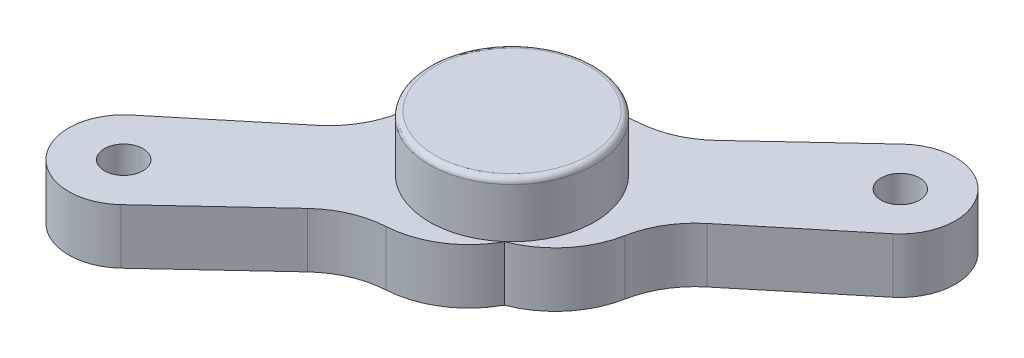
from build123d import *

# Parameters (mm, degrees)
SKETCH1_R           = 7.5
BOSS_EXTRUDE1_DEPTH = 5
SKETCH2_R           = 1.75
BOSS_EXTRUDE2_DEPTH = 5
CIRPATTERN3_COUNT   = 2
FILLET5_R           = 0.5


with BuildPart() as part:
    # Sketch1 → Boss-Extrude1 (new body)
    with BuildSketch(Plane(origin=(0, 0, 0), x_dir=(1, 0, 0), z_dir=(0, 1, 0))):
        with Locations(Location((0, 0, 0), (0, 0, 270))):
            Circle(SKETCH1_R)
    extrude(amount=BOSS_EXTRUDE1_DEPTH)

    # Sketch2 → Boss-Extrude2 (add)
    with BuildSketch(Plane(origin=(0, 0, 0), x_dir=(1, 0, 0), z_dir=(0, 1, 0))):
        with BuildLine():
            Line((12.716294884, 4.995006753), (21.973895335, 12.630243088))
            ThreePointArc((21.973895335, 12.630243088), (22.551056235, 19.785091931), (15.381932825, 20.143764773))
            Line((15.381932825, 20.143764773), (6.607081232, 11.958291083))
            ThreePointArc((6.607081232, 11.958291083), (4.300797699, 10.454751027), (1.621374113, 9.822085487))
            ThreePointArc((1.621374113, 9.822085487), (-2.205943818, 8.582985268), (-4.946272983, 5.637764059))
            Line((-4.946272983, 5.637764059), (0, 0))
            Line((0, 0), (4.946272983, -5.637764059))
            ThreePointArc((4.946272983, -5.637764059), (8.223006092, -3.303936295), (9.949550947, 0.329625974))
            ThreePointArc((9.949550947, 0.329625974), (10.925462035, 2.903955787), (12.716294884, 4.995006753))
        make_face()
        with Locations(Location((18.792546862, 16.487576609, 0), (0, 0, 270))):
            Circle(SKETCH2_R, mode=Mode.SUBTRACT)
    boss_extrude2 = extrude(amount=-BOSS_EXTRUDE2_DEPTH)

    # CirPattern3: Boss-Extrude2 ×2 about axis
    cirpattern3_axis = Axis((0, 0, 0), (0, 1, 0))
    for i in range(1, CIRPATTERN3_COUNT):
        add(boss_extrude2.rotate(cirpattern3_axis, i * 360 / CIRPATTERN3_COUNT))

    # Fillet5
    fillet5_edges = [part.edges().sort_by_distance(p)[0] for p in [
        (0, 5, -7.5),
    ]]
    fillet(fillet5_edges, radius=FILLET5_R)


solid = part.part
